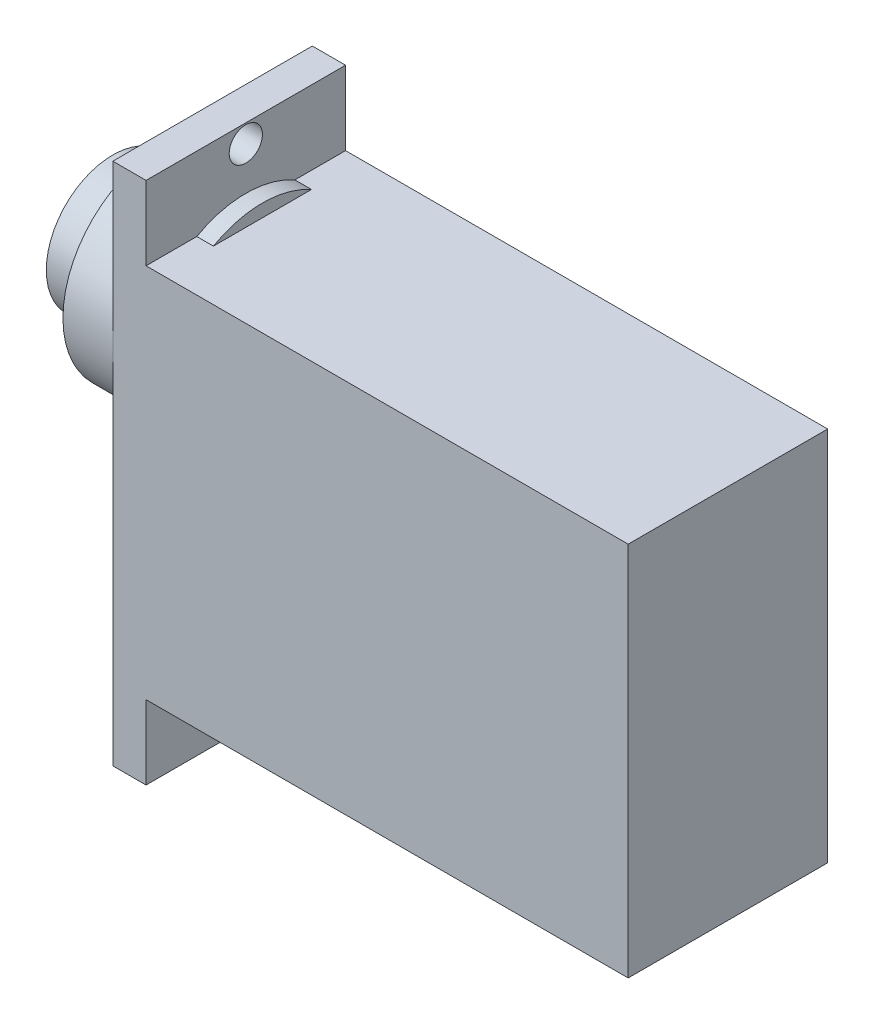
from build123d import *

# Parameters (mm, degrees)
SKETCH1_W           = 31
SKETCH1_H           = 12
BOSS_EXTRUDE1_DEPTH = 11.3
SKETCH3_W           = 2
SKETCH3_H           = 4.45
BOSS_EXTRUDE2_DEPTH = 12
SKETCH4_W           = 2
SKETCH4_H           = 4.45
BOSS_EXTRUDE3_DEPTH = 12
SKETCH5_R           = 1
CUT_EXTRUDE1_DEPTH  = 36.285443174
SKETCH6_R           = 6
BOSS_EXTRUDE4_DEPTH = 3
SKETCH8_R           = 4
BOSS_EXTRUDE5_DEPTH = 3


with BuildPart() as part:
    # Sketch1 → Boss-Extrude1 (new, symmetric)
    with BuildSketch(Plane(origin=(0, 0, 0), x_dir=(1, 0, 0), z_dir=(0, 1, 0))):
        Rectangle(SKETCH1_W, SKETCH1_H)
    extrude(amount=BOSS_EXTRUDE1_DEPTH, both=True)

    # Sketch3 → Boss-Extrude2 (add)
    with BuildSketch(Plane(origin=(0, 0, -6), x_dir=(-1, 0, 0), z_dir=(0, 0, -1))):
        with Locations((14.5, 13.525)):
            Rectangle(SKETCH3_W, SKETCH3_H)
    extrude(amount=-BOSS_EXTRUDE2_DEPTH)

    # Sketch4 → Boss-Extrude3 (add)
    with BuildSketch(Plane(origin=(0, 0, -6), x_dir=(-1, 0, 0), z_dir=(0, 0, -1))):
        with Locations((14.5, -13.525)):
            Rectangle(SKETCH4_W, SKETCH4_H)
    extrude(amount=-BOSS_EXTRUDE3_DEPTH)

    # Sketch5 → Cut-Extrude1 (cut, through all)
    with BuildSketch(Plane.ZY.offset(15.5)):
        with Locations((0, 14.65)):
            Circle(SKETCH5_R)
        with Locations((0, -14.65)):
            Circle(SKETCH5_R)
    extrude(amount=-CUT_EXTRUDE1_DEPTH, mode=Mode.SUBTRACT)

    # Sketch6 → Boss-Extrude4 (add, symmetric)
    with BuildSketch(Plane.ZY.offset(15.5)):
        with Locations((0, 6.07521459)):
            Circle(SKETCH6_R)
    extrude(amount=BOSS_EXTRUDE4_DEPTH, both=True)

    # Sketch8 → Boss-Extrude5 (add, symmetric)
    with BuildSketch(Plane.ZY.offset(18.5)):
        with Locations((0, 6.07521459)):
            Circle(SKETCH8_R)
    extrude(amount=BOSS_EXTRUDE5_DEPTH, both=True)


solid = part.part
